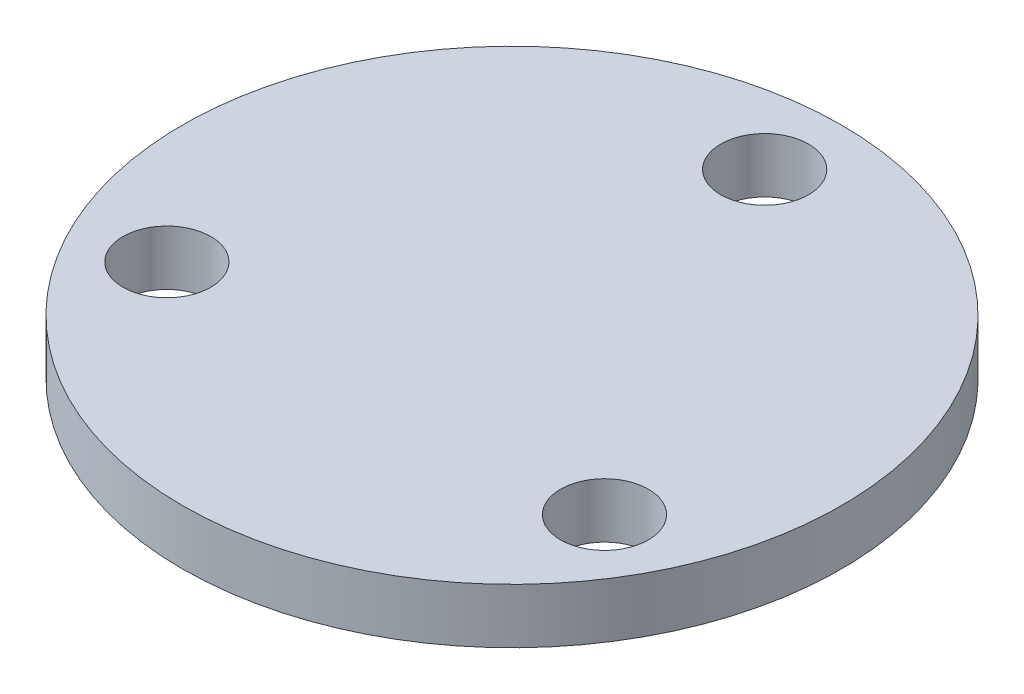
from build123d import *

# Parameters (mm, degrees)
SKETCH_1_R      = 30
SKETCH_1_R_2    = 4
EXTRUDE_1_DEPTH = 5


with BuildPart() as part:
    # 草图1 → 凸台-拉伸1 (new body)
    with BuildSketch(Plane(origin=(0, 0, 0), x_dir=(1, 0, 0), z_dir=(0, 1, 0))):
        with Locations(Location((0, 0, 0), (0, 0, 270))):
            Circle(SKETCH_1_R)
        with Locations(Location((0, 23, 0), (0, 0, 270))):
            Circle(SKETCH_1_R_2, mode=Mode.SUBTRACT)
        with Locations(Location((19.918584287, -11.5, 0), (0, 0, 270))):
            Circle(SKETCH_1_R_2, mode=Mode.SUBTRACT)
        with Locations(Location((-19.918584287, -11.5, 0), (0, 0, 270))):
            Circle(SKETCH_1_R_2, mode=Mode.SUBTRACT)
    extrude(amount=EXTRUDE_1_DEPTH)


solid = part.part
